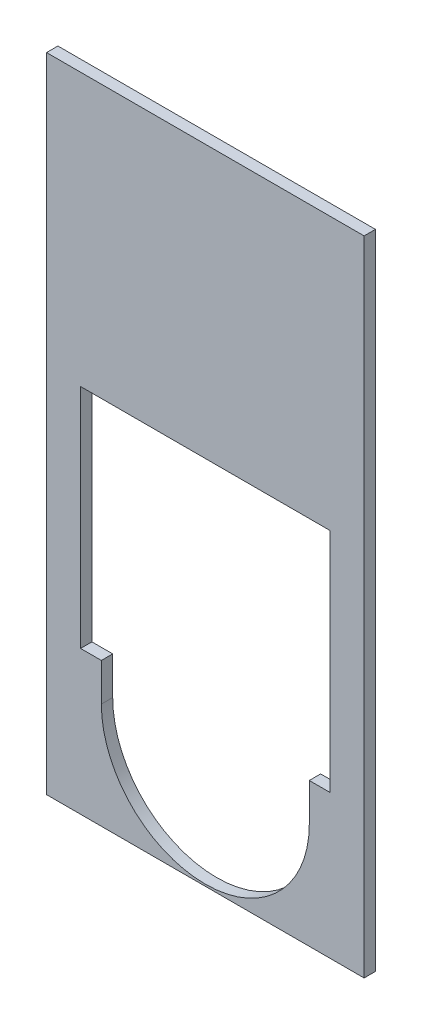
from build123d import *

# Parameters (mm, degrees)
SKETCH_1_W          = 84
SKETCH_1_H          = 170
EXTRUDE_1_DEPTH     = 3
CUT_EXTRUDE_1_DEPTH = 3


with BuildPart() as part:
    # 草图1 → 凸台-拉伸1 (new body)
    with BuildSketch(Plane.XY):
        with Locations((42, 85)):
            Rectangle(SKETCH_1_W, SKETCH_1_H)
    extrude(amount=EXTRUDE_1_DEPTH)

    # 草图2 → 切除-拉伸1 (cut)
    with BuildSketch(Plane.XY.offset(3)):
        with BuildLine():
            Line((75, 98), (9, 98))
            Line((9, 98), (9, 38))
            Line((9, 38), (14.5, 38))
            Line((14.5, 38), (14.5, 28))
            ThreePointArc((14.5, 28), (42, 0.5), (69.5, 28))
            Line((69.5, 28), (69.5, 38))
            Line((69.5, 38), (75, 38))
            Line((75, 38), (75, 98))
        make_face()
    extrude(amount=-CUT_EXTRUDE_1_DEPTH, mode=Mode.SUBTRACT)


solid = part.part
